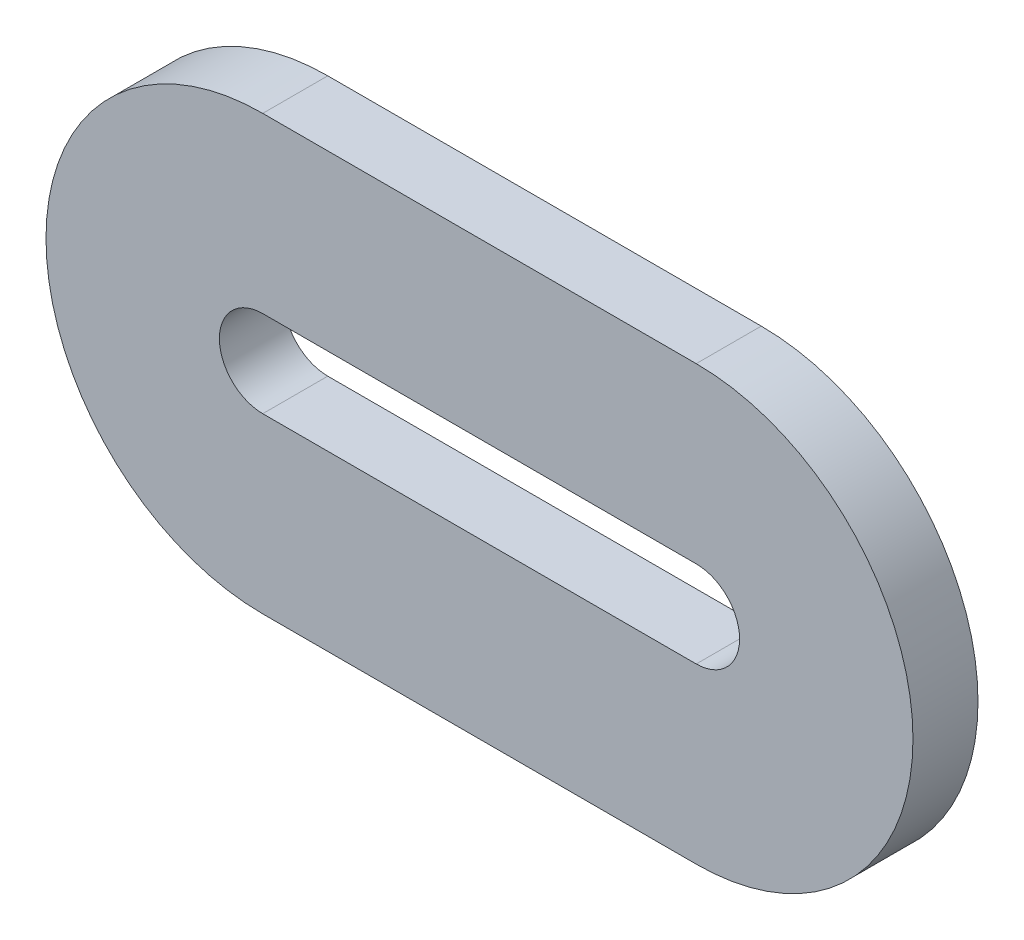
from build123d import *

# Parameters (mm, degrees)
BOSS_EXTRUDE1_DEPTH = 3


with BuildPart() as part:
    # Sketch1 → Boss-Extrude1 (new body)
    with BuildSketch(Plane.XY):
        with BuildLine():
            Line((0, 10), (20, 10))
            ThreePointArc((20, 10), (30, 0), (20, -10))
            Line((20, -10), (0, -10))
            ThreePointArc((0, -10), (-10, 0), (0, 10))
        make_face()
        with BuildLine():
            Line((0, 2), (20, 2))
            ThreePointArc((20, 2), (22, 0), (20, -2))
            Line((20, -2), (0, -2))
            ThreePointArc((0, -2), (-2, 0), (0, 2))
        make_face(mode=Mode.SUBTRACT)
    extrude(amount=BOSS_EXTRUDE1_DEPTH)


solid = part.part
